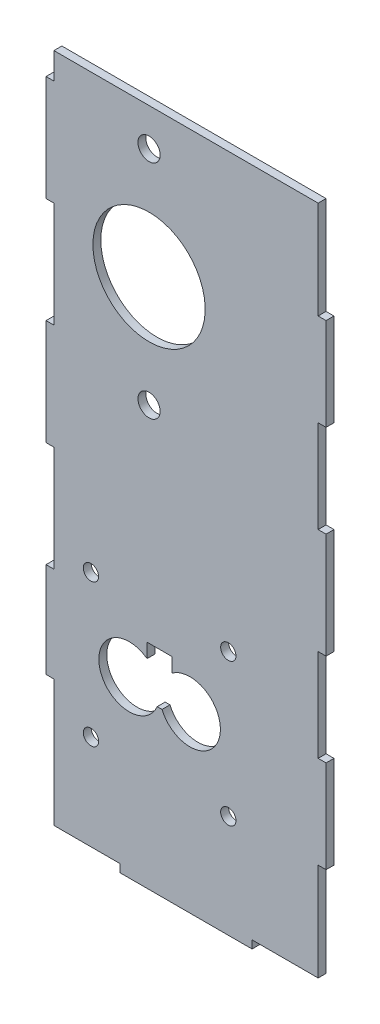
from build123d import *

# Parameters (mm, degrees)
SKETCH1_W           = 100
SKETCH1_H           = 254
BOSS_EXTRUDE1_DEPTH = 3
SKETCH2_W           = 50
SKETCH2_H           = 3
BOSS_EXTRUDE2_DEPTH = 3
SKETCH3_W           = 3
SKETCH3_H           = 35
SKETCH3_H_2         = 40
BOSS_EXTRUDE3_DEPTH = 3
SKETCH4_R           = 4.2
SKETCH4_R_2         = 21.25
SKETCH4_R_3         = 2.9
CUT_EXTRUDE1_DEPTH  = 3
SKETCH5_W           = 3
SKETCH5_H           = 36
SKETCH5_H_2         = 40
BOSS_EXTRUDE4_DEPTH = 3


with BuildPart() as part:
    # Sketch1 → Boss-Extrude1 (new body)
    with BuildSketch(Plane.XY):
        Rectangle(SKETCH1_W, SKETCH1_H)
    extrude(amount=BOSS_EXTRUDE1_DEPTH)

    # Sketch2 → Boss-Extrude2 (add)
    with BuildSketch(Plane.XZ.offset(127)):
        with Locations((0, 1.5)):
            Rectangle(SKETCH2_W, SKETCH2_H)
    extrude(amount=BOSS_EXTRUDE2_DEPTH)

    # Sketch3 → Boss-Extrude3 (add)
    with BuildSketch(Plane(origin=(50, 0, 0), x_dir=(0, 0, -1), z_dir=(1, 0, 0))):
        with Locations((-1.5, 72.5)):
            Rectangle(SKETCH3_W, SKETCH3_H)
        with Locations((-1.5, 0)):
            Rectangle(SKETCH3_W, SKETCH3_H_2)
        with Locations((-1.5, -72.5)):
            Rectangle(SKETCH3_W, SKETCH3_H)
    extrude(amount=BOSS_EXTRUDE3_DEPTH)

    # Sketch4 → Cut-Extrude1 (cut)
    with BuildSketch(Plane(origin=(0, 0, 0), x_dir=(-1, 0, 0), z_dir=(0, 0, -1))):
        with Locations((14, 112.8)):
            Circle(SKETCH4_R)
        with Locations((14, 70.8)):
            Circle(SKETCH4_R_2)
        with Locations((14, 28.8)):
            Circle(SKETCH4_R)
        with Locations((-16, -37)):
            Circle(SKETCH4_R_3)
        with Locations((36, -37)):
            Circle(SKETCH4_R_3)
        with Locations((36, -91)):
            Circle(SKETCH4_R_3)
        with Locations((-16, -91)):
            Circle(SKETCH4_R_3)
        with BuildLine():
            Line((9.083005244, -68.5), (10.916994756, -68.5))
            ThreePointArc((10.916994756, -68.5), (32.581133525, -67.075464159), (14.75, -54.689387775))
            Line((14.75, -54.689387775), (14.75, -49.3))
            Line((14.75, -49.3), (10, -49.3))
            Line((10, -49.3), (5.25, -49.3))
            Line((5.25, -49.3), (5.25, -54.689387775))
            ThreePointArc((5.25, -54.689387775), (-12.581133525, -67.075464159), (9.083005244, -68.5))
        make_face()
    extrude(amount=-CUT_EXTRUDE1_DEPTH, mode=Mode.SUBTRACT)

    # Sketch5 → Boss-Extrude4 (add)
    with BuildSketch(Plane.ZY.offset(50)):
        with Locations((1.5, -61)):
            Rectangle(SKETCH5_W, SKETCH5_H)
        with Locations((1.5, 17)):
            Rectangle(SKETCH5_W, SKETCH5_H_2)
        with Locations((1.5, 97)):
            Rectangle(SKETCH5_W, SKETCH5_H_2)
    extrude(amount=BOSS_EXTRUDE4_DEPTH)


solid = part.part
